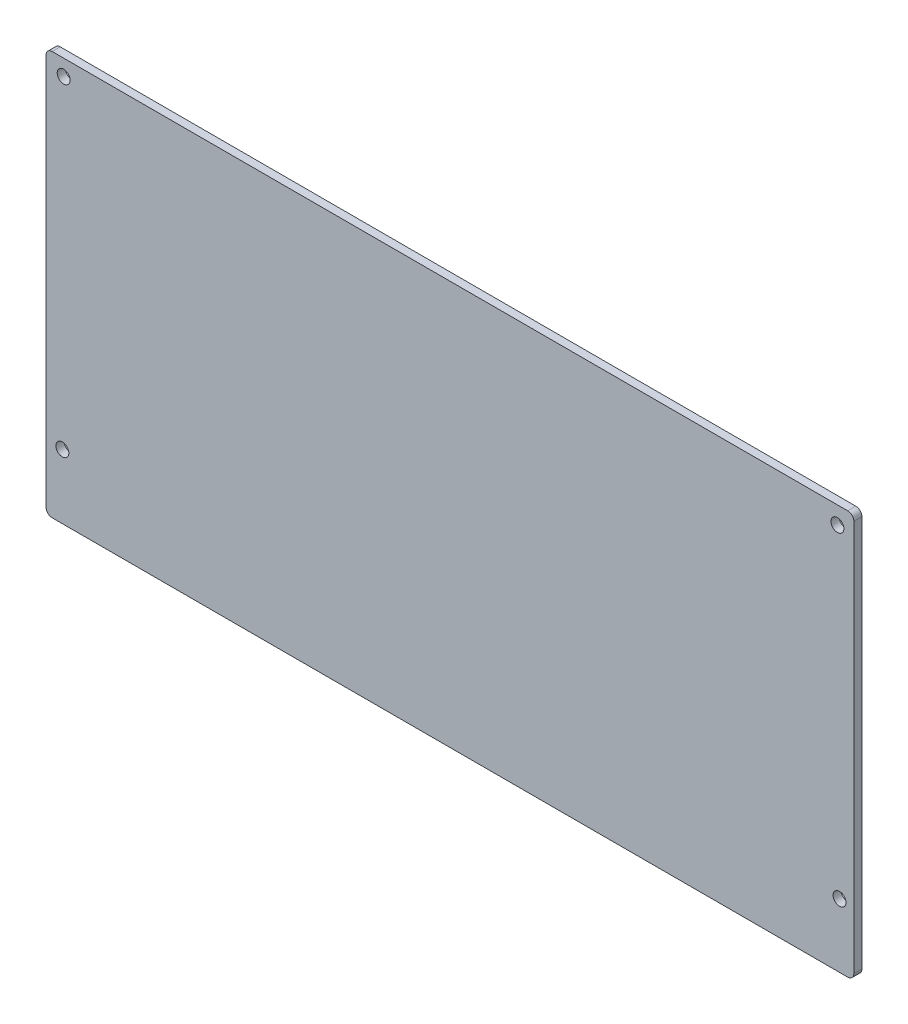
from build123d import *

# Parameters (mm, degrees)
SKETCH_1_W          = 200
SKETCH_1_H          = 100.000000001
EXTRUDE_1_DEPTH     = 2
SKETCH_2_R          = 1.6
CUT_EXTRUDE_1_DEPTH = 2
FILLET_1_R          = 1.5


with BuildPart() as part:
    # 草图1 → 凸台-拉伸1 (new body)
    with BuildSketch(Plane.XY.offset(14.6000508)):
        with Locations((142.68478537, -194.843789688)):
            Rectangle(SKETCH_1_W, SKETCH_1_H)
    extrude(amount=EXTRUDE_1_DEPTH)

    # 草图2 → 切除-拉伸1 (cut)
    with BuildSketch(Plane.XY.offset(16.6000508)):
        with Locations((47.033603413, -148.804542119)):
            Circle(SKETCH_2_R)
        with Locations((238.624235091, -149.169262017)):
            Circle(SKETCH_2_R)
        with Locations((46.707705004, -228.912665547)):
            Circle(SKETCH_2_R)
        with Locations((239.14686479, -229.07501855)):
            Circle(SKETCH_2_R)
    extrude(amount=-CUT_EXTRUDE_1_DEPTH, mode=Mode.SUBTRACT)

    # 圆角1
    fillet_1_edges = [part.edges().sort_by_distance(p)[0] for p in [
        (42.68478537, -144.843789687, 15.6000508),
        (242.68478537, -144.843789687, 15.6000508),
        (242.68478537, -244.843789688, 15.6000508),
        (42.68478537, -244.843789688, 15.6000508),
    ]]
    fillet(fillet_1_edges, radius=FILLET_1_R)


solid = part.part
